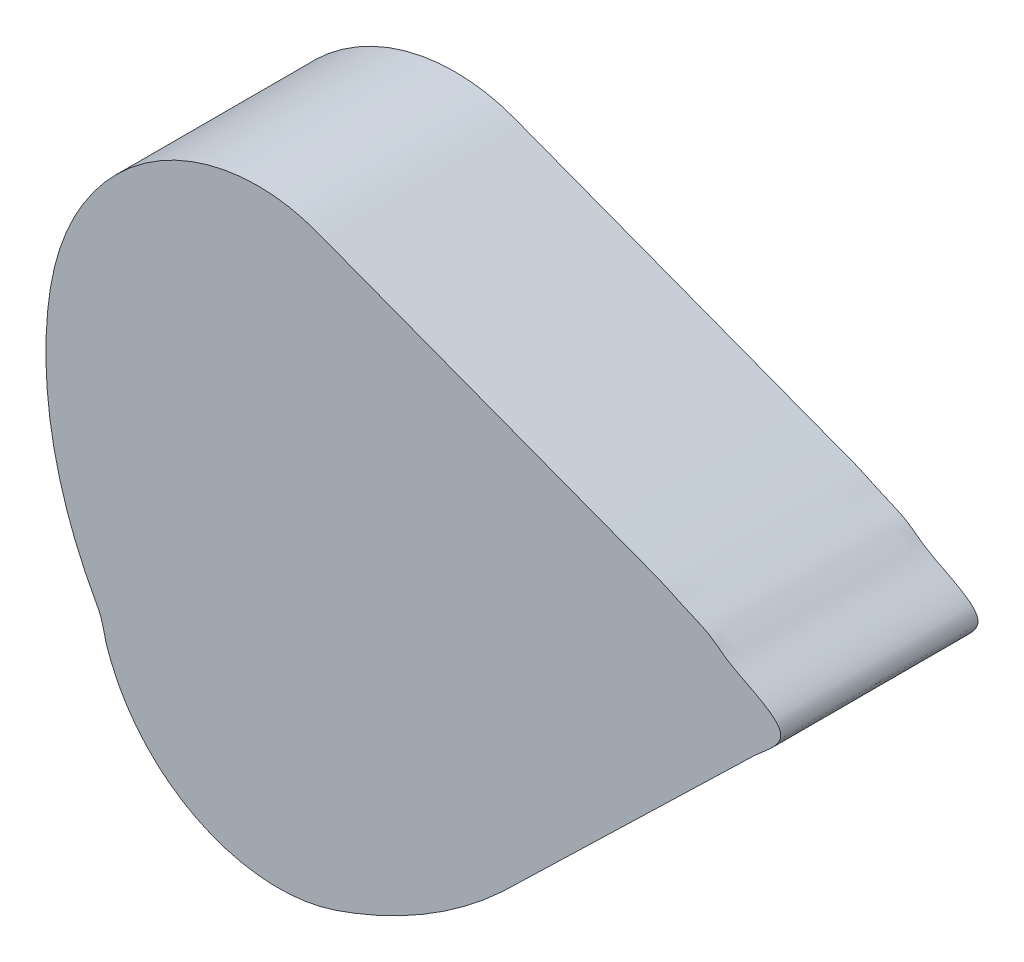
from build123d import *

# Parameters (mm, degrees)
BOSS_EXTRUDE1_DEPTH = 10


with BuildPart() as part:
    # 3DSketch1 → Boss-Extrude1 (new body)
    with BuildSketch(Plane(origin=(20.580175011, -0.003282043, 0), x_dir=(-0.9937703775318802, -0.11144701315039465, 0), z_dir=(0, 0, 1))):
        with BuildLine():
            add(Edge.make_bspline(
                [(0, 0), (-0.046757783, -0.748521475), (2.299556262, -1.853145427), (3.216313907, -3.004781814), (4.63499743, -3.729383954), (5.495095822, -4.324784176), (6.557126253, -4.822251923), (7.407841594, -5.282640526), (8.275970607, -5.716217109), (8.9850133, -6.085927982), (9.651506237, -6.425750977), (10.250485376, -6.734293052), (10.85249982, -7.043005495), (11.393311, -7.320790209), (11.934451883, -7.598593999), (12.415389216, -7.845525936), (12.896339675, -8.092458718), (13.31717332, -8.308524991), (13.738004933, -8.524591174), (14.09871816, -8.709790821), (14.459431491, -8.894990451), (14.820144675, -9.080190191), (15.18085794, -9.265389788), (15.541571153, -9.450589508), (15.902284353, -9.635789246), (16.262997549, -9.820988991), (16.623710911, -10.006188412), (16.984424305, -10.191387771), (17.345137493, -10.376587535), (17.705850548, -10.561787553), (18.126682695, -10.777853741), (18.547514682, -10.993920324), (18.96834729, -11.209985522), (19.329060296, -11.3951855), (19.749888824, -11.611259749), (20.170733721, -11.827300063), (20.651671714, -12.07425294), (21.132540965, -12.321380081), (21.674141927, -12.598038097), (22.213105416, -12.880150234), (22.763258936, -13.139963307), (23.333796447, -13.352627575), (23.917382582, -13.525041392), (24.51191963, -13.655319469), (25.180816875, -13.754449911), (25.855715967, -13.800726082), (26.531862575, -13.795409868), (27.206275767, -13.74684666), (27.875563765, -13.649062743), (28.53591251, -13.503856761), (29.186385261, -13.319462028), (29.822810101, -13.090487654), (30.503926067, -12.791985966), (31.104294031, -12.480567253), (31.740639499, -12.095747745), (32.35076659, -11.670133009), (32.981855013, -11.160018664), (33.525241627, -10.652021634), (34.037198894, -10.11264907), (34.514614297, -9.54225396), (34.953049663, -8.941384137), (35.35458323, -8.315476), (35.718202878, -7.666578456), (36.066384367, -6.933660583), (36.365815396, -6.179537897), (36.59745292, -5.472823121), (36.793911532, -4.755712526), (36.958016442, -4.030417372), (37.099816767, -3.231777022), (37.210112295, -2.428181181), (37.289290243, -1.620951222), (37.334329419, -0.811025165), (37.345839968, 0), (37.325659398, 0.743293239), (37.274400811, 1.552720379), (37.189913926, 2.359540058), (37.058164355, 3.228361715), (36.90402239, 4.024645687), (36.718100299, 4.814322645), (36.481086928, 5.660209532), (36.208354602, 6.496142835), (35.897649527, 7.316930323), (35.531624739, 8.122134225), (35.491532859, 9.080563724), (35.23848077, 9.994550554), (34.935580161, 10.890473235), (34.530515966, 11.748586045), (34.003688938, 12.615474832), (33.380425745, 13.417727423), (32.722247722, 14.098971369), (31.996836584, 14.708319027), (31.216625699, 15.245729972), (30.380689814, 15.692445802), (29.504682308, 16.052415537), (28.596774744, 16.323691026), (27.597789699, 16.505763629), (26.652403282, 16.569282431), (25.70559268, 16.540791032), (24.766463614, 16.414038324), (23.780101571, 16.176912074), (22.802621093, 15.908690609), (21.902777228, 15.615042761), (21.014061103, 15.290424856), (20.20170361, 14.955155545), (19.402706344, 14.589646267), (18.67745181, 14.226448908), (17.965190957, 13.838504987), (17.266762191, 13.426069802), (16.583229802, 12.989510061), (15.970119344, 12.56889196), (15.371195244, 12.128452217), (14.783962751, 11.672565203), (14.195288063, 11.218643529), (13.66042666, 10.80556312), (13.125506538, 10.392574239), (12.590594607, 9.979569243), (12.002191158, 9.525266456), (11.467278206, 9.112263723), (10.93236616, 8.699261525), (10.397451798, 8.286257878), (9.862545409, 7.873256113), (9.274126789, 7.418950834), (8.685760597, 6.964654067), (8.097270747, 6.510336713), (7.509068022, 6.056066918), (6.920170469, 5.601682465), (6.27934741, 5.106255993), (5.581670385, 4.568975022), (4.891003667, 4.032846756), (4.132766993, 3.453123637), (3.403392397, 2.877939139), (2.505965201, 2.211719501), (1.413634216, 1.270141784), (0.033005494, 0.5283681), (0, 0)],
                knots=[0, 0, 0, 0, 0.033203125, 0.044921875, 0.05859375, 0.0703125, 0.080078125, 0.08984375, 0.099609375, 0.107421875, 0.11328125, 0.12109375, 0.126953125, 0.1328125, 0.138671875, 0.14453125, 0.1484375, 0.154296875, 0.158203125, 0.162109375, 0.166015625, 0.169921875, 0.173828125, 0.177734375, 0.181640625, 0.185546875, 0.189453125, 0.193359375, 0.197265625, 0.201171875, 0.205078125, 0.2109375, 0.21484375, 0.21875, 0.22265625, 0.228515625, 0.232421875, 0.23828125, 0.244140625, 0.25, 0.255859375, 0.26171875, 0.267578125, 0.2734375, 0.279296875, 0.287109375, 0.29296875, 0.298828125, 0.306640625, 0.3125, 0.318359375, 0.326171875, 0.33203125, 0.33984375, 0.345703125, 0.353515625, 0.361328125, 0.369140625, 0.375, 0.3828125, 0.390625, 0.396484375, 0.404296875, 0.412109375, 0.419921875, 0.427734375, 0.43359375, 0.44140625, 0.44921875, 0.45703125, 0.46484375, 0.47265625, 0.48046875, 0.48828125, 0.494140625, 0.50390625, 0.51171875, 0.51953125, 0.52734375, 0.53515625, 0.544921875, 0.552734375, 0.560546875, 0.5703125, 0.580078125, 0.587890625, 0.59765625, 0.607421875, 0.6171875, 0.626953125, 0.634765625, 0.64453125, 0.654296875, 0.662109375, 0.671875, 0.681640625, 0.69140625, 0.69921875, 0.708984375, 0.71875, 0.728515625, 0.73828125, 0.74609375, 0.755859375, 0.763671875, 0.771484375, 0.779296875, 0.787109375, 0.794921875, 0.802734375, 0.80859375, 0.81640625, 0.82421875, 0.830078125, 0.8359375, 0.84375, 0.849609375, 0.857421875, 0.86328125, 0.869140625, 0.876953125, 0.8828125, 0.890625, 0.8984375, 0.904296875, 0.912109375, 0.919921875, 0.927734375, 0.9375, 0.9453125, 0.955078125, 0.96484375, 0.9765625, 1, 1, 1, 1], degree=3))
        make_face()
    extrude(amount=BOSS_EXTRUDE1_DEPTH)


solid = part.part
